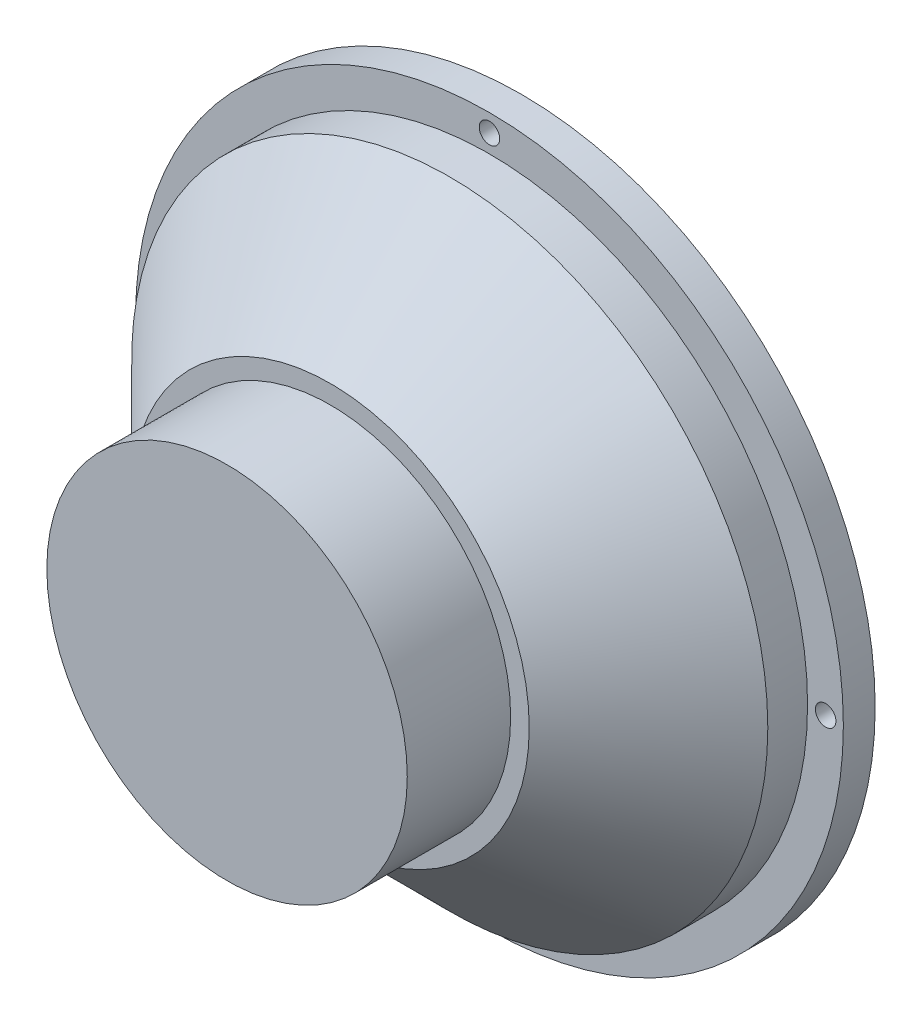
from build123d import *

# Parameters (mm, degrees)
SKETCH1_R           = 89
BOSS_EXTRUDE1_DEPTH = 8
SKETCH2_R           = 80
BOSS_EXTRUDE2_DEPTH = 40
CHAMFER2_SIZE       = 30
SKETCH5_R           = 45.325276546
BOSS_EXTRUDE3_DEPTH = 26
SKETCH6_R           = 2.574541915
CUT_EXTRUDE1_DEPTH  = 26


with BuildPart() as part:
    # Sketch1 → Boss-Extrude1 (new body)
    with BuildSketch(Plane.XY):
        Circle(SKETCH1_R)
    extrude(amount=BOSS_EXTRUDE1_DEPTH)

    # Sketch2 → Boss-Extrude2 (add)
    with BuildSketch(Plane.XY.offset(8)):
        Circle(SKETCH2_R)
    extrude(amount=BOSS_EXTRUDE2_DEPTH)

    # Chamfer2
    chamfer2_edges = [part.edges().sort_by_distance(p)[0] for p in [
        (-80, 0, 48),
    ]]
    chamfer(chamfer2_edges, length=CHAMFER2_SIZE)

    # Sketch5 → Boss-Extrude3 (add)
    with BuildSketch(Plane.XY.offset(48)):
        Circle(SKETCH5_R)
    extrude(amount=BOSS_EXTRUDE3_DEPTH)

    # Sketch6 → Cut-Extrude1 (cut)
    with BuildSketch(Plane.XY.offset(8)):
        with Locations((0, 84.547956484)):
            Circle(SKETCH6_R)
        with Locations((84.547956484, 0)):
            Circle(SKETCH6_R)
        with Locations((0, -84.547956484)):
            Circle(SKETCH6_R)
        with Locations((-84.547956484, 0)):
            Circle(SKETCH6_R)
    extrude(amount=-CUT_EXTRUDE1_DEPTH, mode=Mode.SUBTRACT)


solid = part.part
